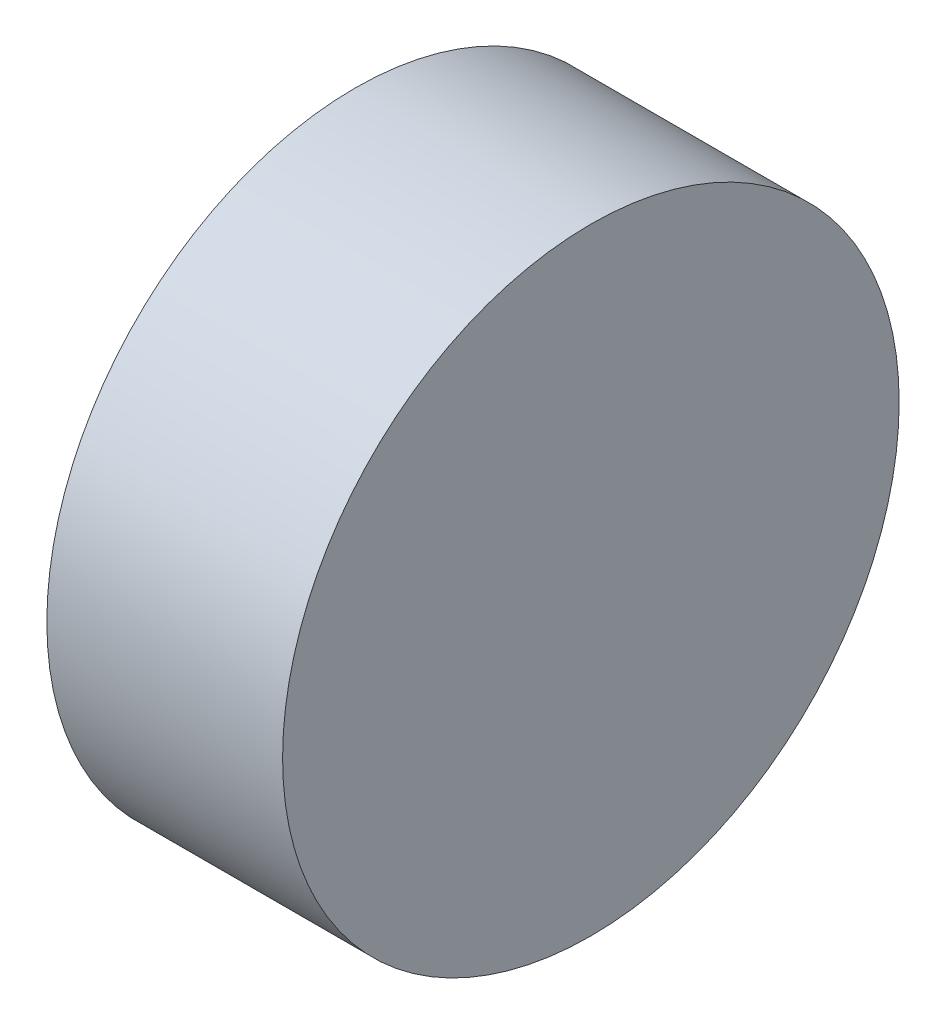
from build123d import *

# Parameters (mm, degrees)
ESBO_O1_R                = 34
RESSALTO_EXTRUS_O1_DEPTH = 26


with BuildPart() as part:
    # Esboço1 → Ressalto-extrusão1 (new body)
    with BuildSketch(Plane(origin=(0, 0, 0), x_dir=(0, 0, -1), z_dir=(1, 0, 0))):
        with Locations(Location((0, 0, 0), (0, 0, 180))):
            Circle(ESBO_O1_R)
    extrude(amount=RESSALTO_EXTRUS_O1_DEPTH)


solid = part.part
